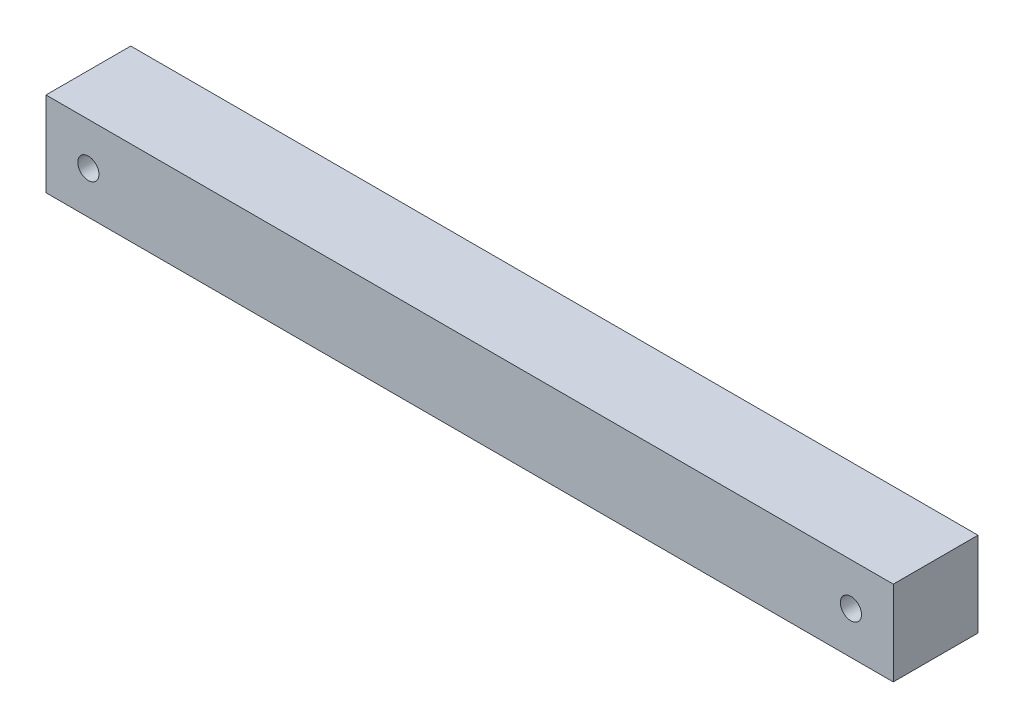
from build123d import *

# Parameters (mm, degrees)
SKETCH1_W      = 254
SKETCH1_H      = 25.4
SKETCH1_R      = 3.175
EXTRUDE1_DEPTH = 12.7


with BuildPart() as part:
    # Sketch1 → Extrude1 (new, symmetric)
    with BuildSketch(Plane.XY):
        with Locations((3785.010467877, 341.002188153)):
            Rectangle(SKETCH1_W, SKETCH1_H)
        with Locations((3670.710467877, 341.002188153)):
            Circle(SKETCH1_R, mode=Mode.SUBTRACT)
        with Locations((3899.310467877, 341.002188153)):
            Circle(SKETCH1_R, mode=Mode.SUBTRACT)
    extrude(amount=EXTRUDE1_DEPTH, both=True)


solid = part.part
